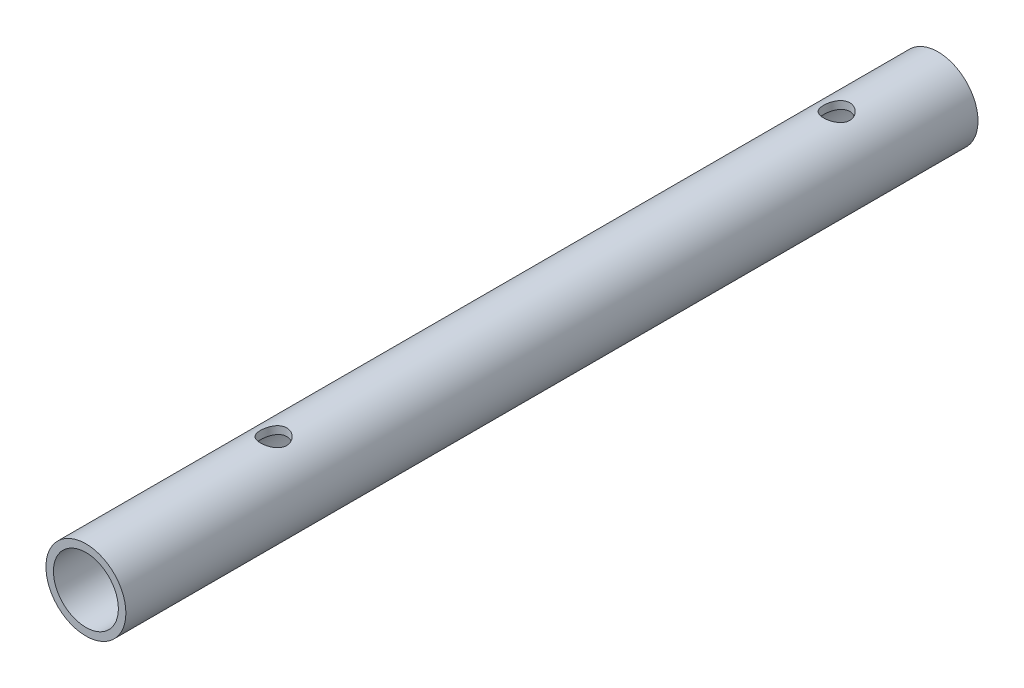
from build123d import *

# Parameters (mm, degrees)
SKETCH1_R           = 10.65
SKETCH1_R_2         = 8.65
BOSS_EXTRUDE1_DEPTH = 227
SKETCH2_R           = 3.5
CUT_EXTRUDE1_DEPTH  = 228.499109888
LPATTERN1_COUNT     = 2
LPATTERN1_PITCH     = 150


with BuildPart() as part:
    # Sketch1 → Boss-Extrude1 (new body)
    with BuildSketch(Plane.XY):
        with Locations(Location((0, 0, 0), (0, 0, 180))):
            Circle(SKETCH1_R)
        with Locations(Location((0, 0, 0), (0, 0, 180))):
            Circle(SKETCH1_R_2, mode=Mode.SUBTRACT)
    extrude(amount=BOSS_EXTRUDE1_DEPTH)

    # Sketch2 → Cut-Extrude1 (cut, symmetric)
    with BuildSketch(Plane(origin=(0, 0, 0), x_dir=(1, 0, 0), z_dir=(0, 1, 0))):
        with Locations(Location((0, -177, 0), (0, 0, 270))):
            Circle(SKETCH2_R)
    cut_extrude1 = extrude(amount=CUT_EXTRUDE1_DEPTH, both=True, mode=Mode.SUBTRACT)

    # LPattern1: Cut-Extrude1 ×2
    with Locations(*[(0, 0, -i * LPATTERN1_PITCH) for i in range(1, LPATTERN1_COUNT)]):
        add(cut_extrude1, mode=Mode.SUBTRACT)


solid = part.part
